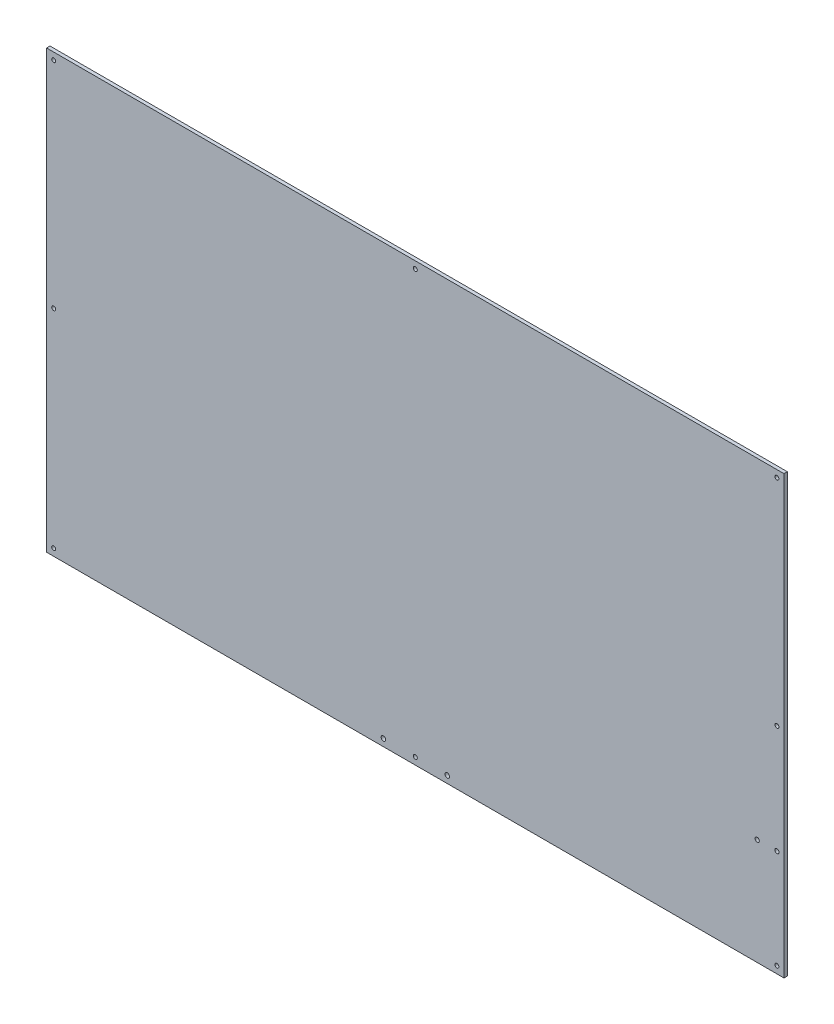
from build123d import *

# Parameters (mm, degrees)
SKETCH1_W           = 1040
SKETCH1_H           = 616
SKETCH1_R           = 2.8
SKETCH1_R_2         = 3.25
SKETCH1_R_3         = 3
BOSS_EXTRUDE1_DEPTH = 4.7625


with BuildPart() as part:
    # Sketch1 → Boss-Extrude1 (new body)
    with BuildSketch(Plane.XY):
        with Locations((520, 308)):
            Rectangle(SKETCH1_W, SKETCH1_H)
        with Locations((10, 606)):
            Circle(SKETCH1_R, mode=Mode.SUBTRACT)
        with Locations((520, 606)):
            Circle(SKETCH1_R, mode=Mode.SUBTRACT)
        with Locations((1030, 606)):
            Circle(SKETCH1_R, mode=Mode.SUBTRACT)
        with Locations((10, 303)):
            Circle(SKETCH1_R, mode=Mode.SUBTRACT)
        with Locations((10, 10)):
            Circle(SKETCH1_R, mode=Mode.SUBTRACT)
        with Locations((520, 10)):
            Circle(SKETCH1_R, mode=Mode.SUBTRACT)
        with Locations((1030, 10)):
            Circle(SKETCH1_R, mode=Mode.SUBTRACT)
        with Locations((1030, 303)):
            Circle(SKETCH1_R, mode=Mode.SUBTRACT)
        with Locations((475, 10)):
            Circle(SKETCH1_R_2, mode=Mode.SUBTRACT)
        with Locations((565, 10)):
            Circle(SKETCH1_R_2, mode=Mode.SUBTRACT)
        with Locations((1030, 150)):
            Circle(SKETCH1_R_3, mode=Mode.SUBTRACT)
        with Locations((1002.2, 150)):
            Circle(SKETCH1_R_3, mode=Mode.SUBTRACT)
    extrude(amount=-BOSS_EXTRUDE1_DEPTH)


solid = part.part
